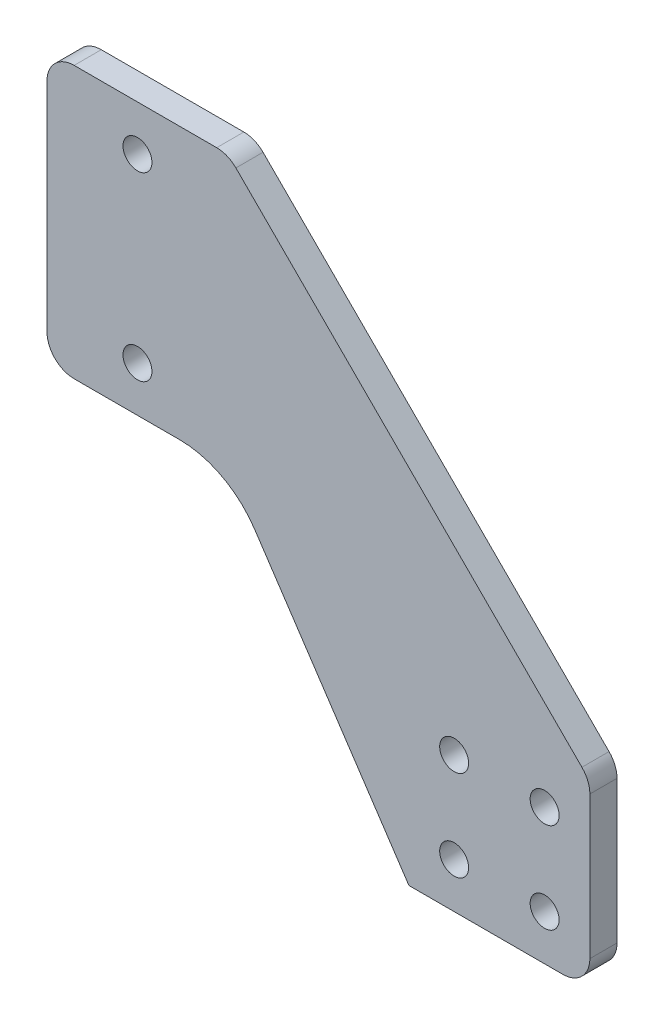
from build123d import *

# Parameters (mm, degrees)
SKETCH_1_R          = 1.6
EXTRUDE_1_DEPTH     = 3
CUT_EXTRUDE_1_DEPTH = 85.905830189
FILLET_1_R          = 3
FILLET_2_R          = 10


with BuildPart() as part:
    # 草图1 → 凸台-拉伸1 (new body)
    with BuildSketch(Plane.XY):
        Polygon((0, 0), (20, 0), (60, -40), (60, -60), (0, -60), align=None)
        with Locations((10, -5)):
            Circle(SKETCH_1_R, mode=Mode.SUBTRACT)
        with Locations((10, -25)):
            Circle(SKETCH_1_R, mode=Mode.SUBTRACT)
        with Locations((55, -55)):
            Circle(SKETCH_1_R, mode=Mode.SUBTRACT)
        with Locations(Location((55, -45, 0), (0, 0, 180))):
            Circle(SKETCH_1_R, mode=Mode.SUBTRACT)
        with Locations(Location((45, -55, 0), (0, 0, 180))):
            Circle(SKETCH_1_R, mode=Mode.SUBTRACT)
        with Locations((45, -45)):
            Circle(SKETCH_1_R, mode=Mode.SUBTRACT)
    extrude(amount=EXTRUDE_1_DEPTH)

    # 草图2 → 切除-拉伸1 (cut, through all)
    with BuildSketch(Plane.XY.offset(3)):
        Polygon((40, -60), (0, -60), (0, -30), (20, -30), align=None)
    extrude(amount=-CUT_EXTRUDE_1_DEPTH, mode=Mode.SUBTRACT)

    # 圆角1
    fillet_1_edges = [part.edges().sort_by_distance(p)[0] for p in [
        (0, -30, 1.5),
        (0, 0, 1.5),
        (20, 0, 1.5),
        (60, -40, 1.5),
        (60, -60, 1.5),
    ]]
    fillet(fillet_1_edges, radius=FILLET_1_R)

    # 圆角2
    fillet_2_edges = [part.edges().sort_by_distance(p)[0] for p in [
        (20, -30, 1.5),
    ]]
    fillet(fillet_2_edges, radius=FILLET_2_R)


solid = part.part
